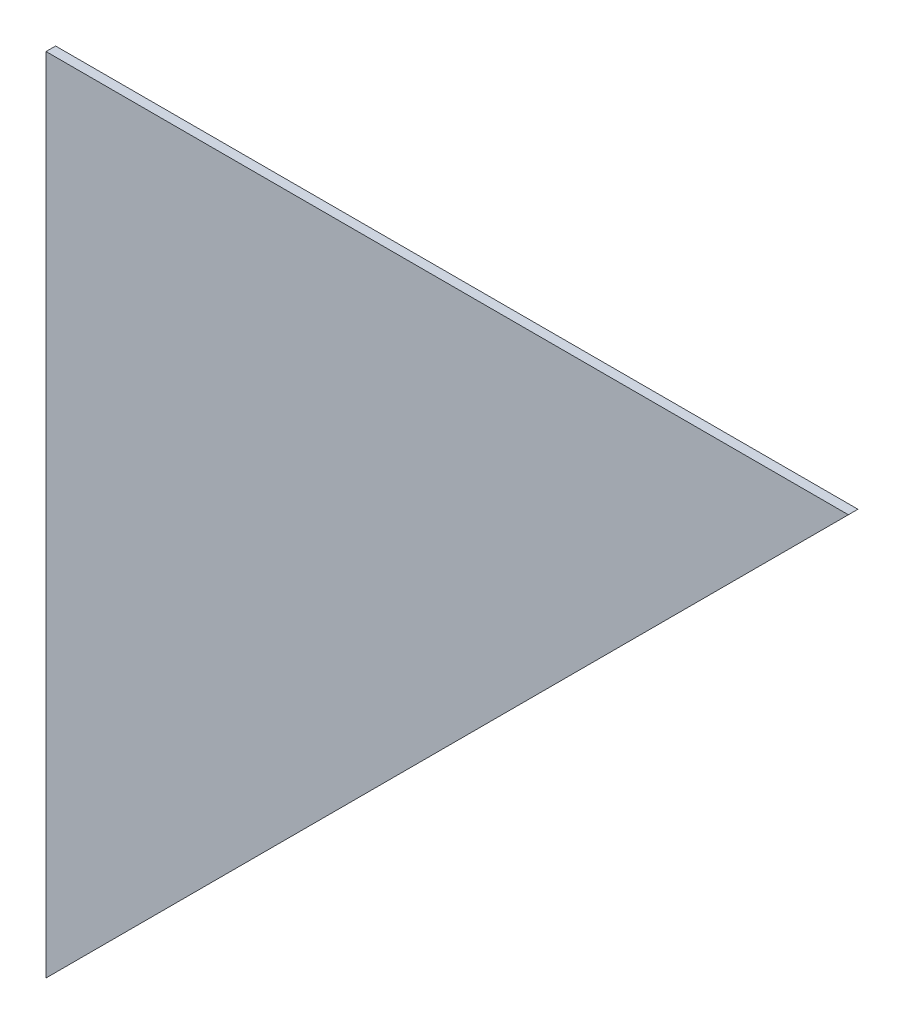
from build123d import *

# Parameters (mm, degrees)
BOSS_EXTRUDE1_DEPTH = 0.13


with BuildPart() as part:
    # Sketch2 → Boss-Extrude1 (new body)
    with BuildSketch(Plane.XY):
        Polygon((-9.15185069, 19.556844847), (1.74814931, 19.556844847), (-9.15185069, 8.656844847), align=None)
    extrude(amount=BOSS_EXTRUDE1_DEPTH)


solid = part.part
